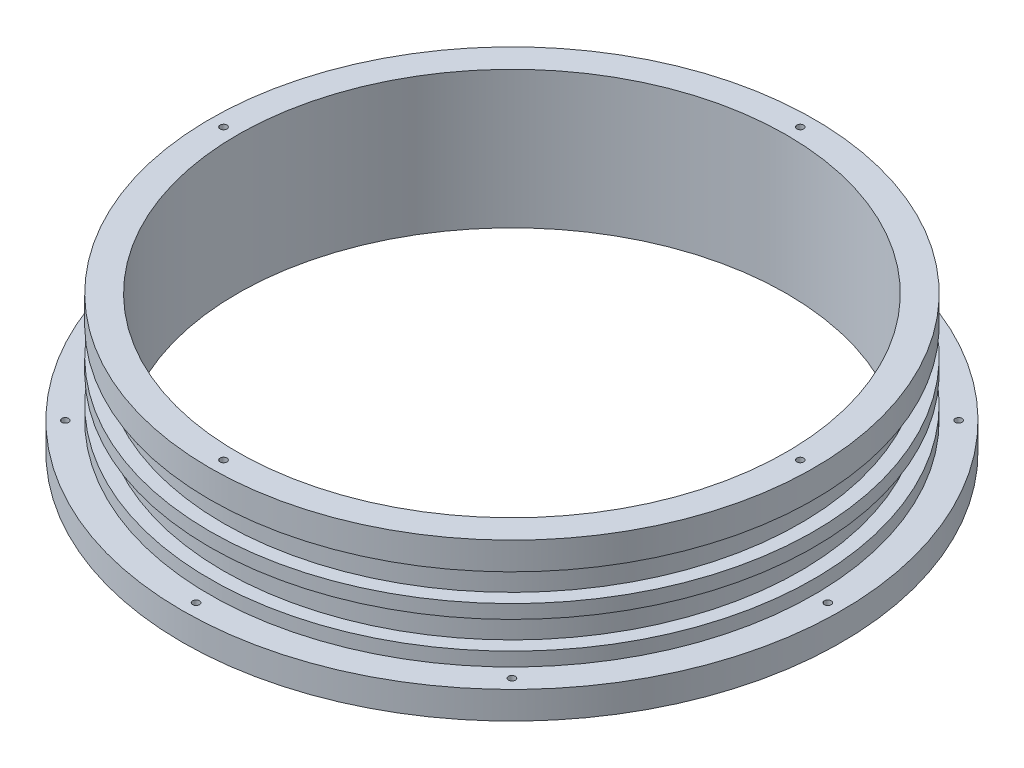
from build123d import *

# Parameters (mm, degrees)
SKETCH2_R           = 76.2
BOSS_EXTRUDE1_DEPTH = 6.35
SKETCH3_R           = 69.85
BOSS_EXTRUDE2_DEPTH = 9.525
SKETCH4_R           = 66.675
BOSS_EXTRUDE3_DEPTH = 15.875
SKETCH6_R           = 69.85
BOSS_EXTRUDE4_DEPTH = 3.175
SKETCH7_R           = 66.675
BOSS_EXTRUDE5_DEPTH = 6.35
SKETCH8_R           = 69.85
BOSS_EXTRUDE6_DEPTH = 6.35
SKETCH9_R           = 63.5
CUT_EXTRUDE1_DEPTH  = 113.342968182
SKETCH10_R          = 0.79375
CUT_EXTRUDE2_DEPTH  = 111.716033166
SKETCH11_R          = 69.85
SKETCH11_R_2        = 66.675
CUT_EXTRUDE3_DEPTH  = 3.175
SKETCH12_R          = 0.79375
CUT_EXTRUDE4_DEPTH  = 3.175


with BuildPart() as part:
    # Sketch2 → Boss-Extrude1 (new body)
    with BuildSketch(Plane(origin=(0, 0, 0), x_dir=(1, 0, 0), z_dir=(0, 1, 0))):
        with Locations(Location((0, 0, 0), (0, 0, 270))):
            Circle(SKETCH2_R)
    extrude(amount=BOSS_EXTRUDE1_DEPTH)

    # Sketch3 → Boss-Extrude2 (add)
    with BuildSketch(Plane(origin=(0, 0, 0), x_dir=(1, 0, 0), z_dir=(0, 1, 0))):
        with Locations(Location((0, 0, 0), (0, 0, 90))):
            Circle(SKETCH3_R)
    extrude(amount=BOSS_EXTRUDE2_DEPTH)

    # Sketch4 → Boss-Extrude3 (add)
    with BuildSketch(Plane(origin=(0, 0, 0), x_dir=(1, 0, 0), z_dir=(0, 1, 0))):
        with Locations(Location((0, 0, 0), (0, 0, 270))):
            Circle(SKETCH4_R)
    extrude(amount=BOSS_EXTRUDE3_DEPTH)

    # Sketch6 → Boss-Extrude4 (add)
    with BuildSketch(Plane(origin=(0, 15.875, 0), x_dir=(1, 0, 0), z_dir=(0, 1, 0))):
        with Locations(Location((0, 0, 0), (0, 0, 90))):
            Circle(SKETCH6_R)
    extrude(amount=BOSS_EXTRUDE4_DEPTH)

    # Sketch7 → Boss-Extrude5 (add)
    with BuildSketch(Plane(origin=(0, 19.05, 0), x_dir=(1, 0, 0), z_dir=(0, 1, 0))):
        with Locations(Location((0, 0, 0), (0, 0, 270))):
            Circle(SKETCH7_R)
    extrude(amount=BOSS_EXTRUDE5_DEPTH)

    # Sketch8 → Boss-Extrude6 (add)
    with BuildSketch(Plane(origin=(0, 25.4, 0), x_dir=(1, 0, 0), z_dir=(0, 1, 0))):
        with Locations(Location((0, 0, 0), (0, 0, 90))):
            Circle(SKETCH8_R)
    extrude(amount=BOSS_EXTRUDE6_DEPTH)

    # Sketch9 → Cut-Extrude1 (cut, through all)
    with BuildSketch(Plane.XZ):
        with Locations(Location((0, 0, 0), (0, 0, 270))):
            Circle(SKETCH9_R)
    extrude(amount=-CUT_EXTRUDE1_DEPTH, mode=Mode.SUBTRACT)

    # Sketch10 → Cut-Extrude2 (cut, through all)
    with BuildSketch(Plane(origin=(0, 6.35, 0), x_dir=(1, 0, 0), z_dir=(0, 1, 0))):
        with Locations(Location((0, 73.025, 0), (0, 0, 270))):
            Circle(SKETCH10_R)
        with Locations(Location((51.636472696, 51.636472696, 0), (0, 0, 270))):
            Circle(SKETCH10_R)
        with Locations(Location((73.025, 0, 0), (0, 0, 270))):
            Circle(SKETCH10_R)
        with Locations(Location((51.636472696, -51.636472696, 0), (0, 0, 270))):
            Circle(SKETCH10_R)
        with Locations(Location((0, -73.025, 0), (0, 0, 270))):
            Circle(SKETCH10_R)
        with Locations(Location((-51.636472696, -51.636472696, 0), (0, 0, 270))):
            Circle(SKETCH10_R)
        with Locations(Location((-73.025, 0, 0), (0, 0, 270))):
            Circle(SKETCH10_R)
        with Locations(Location((-51.636472696, 51.636472696, 0), (0, 0, 270))):
            Circle(SKETCH10_R)
    extrude(amount=-CUT_EXTRUDE2_DEPTH, mode=Mode.SUBTRACT)

    # Sketch11 → Cut-Extrude3 (cut)
    with BuildSketch(Plane.XZ):
        with Locations(Location((0, 0, 0), (0, 0, 270))):
            Circle(SKETCH11_R)
        with Locations(Location((0, 0, 0), (0, 0, 90))):
            Circle(SKETCH11_R_2, mode=Mode.SUBTRACT)
    extrude(amount=-CUT_EXTRUDE3_DEPTH, mode=Mode.SUBTRACT)

    # Sketch12 → Cut-Extrude4 (cut)
    with BuildSketch(Plane(origin=(0, 31.75, 0), x_dir=(1, 0, 0), z_dir=(0, 1, 0))):
        with Locations(Location((0, 66.675, 0), (0, 0, 270))):
            Circle(SKETCH12_R)
        with Locations(Location((66.675, 0, 0), (0, 0, 270))):
            Circle(SKETCH12_R)
        with Locations(Location((0, -66.675, 0), (0, 0, 270))):
            Circle(SKETCH12_R)
        with Locations(Location((-66.675, 0, 0), (0, 0, 270))):
            Circle(SKETCH12_R)
    extrude(amount=-CUT_EXTRUDE4_DEPTH, mode=Mode.SUBTRACT)


solid = part.part
